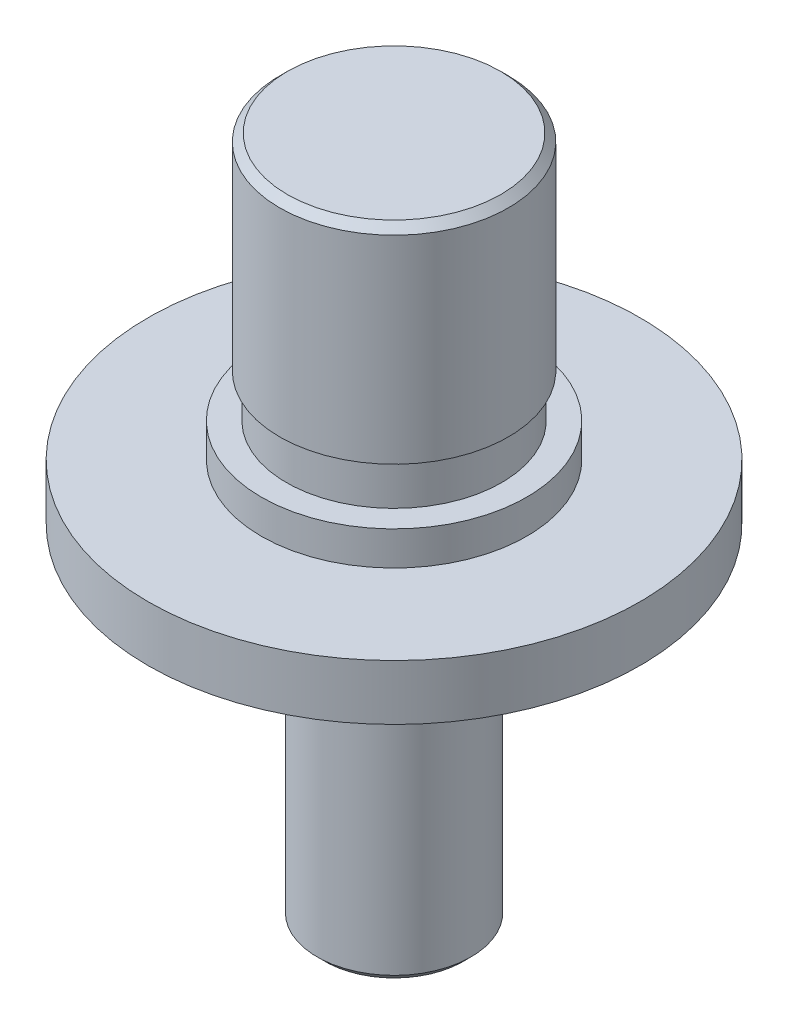
from build123d import *

# Parameters (mm, degrees)
SKETCH16_R         = 52.5
SKETCH16_R_2       = 50.8
CUT_EXTRUDE1_DEPTH = 11.43


with BuildPart() as part:
    # Sketch1 → Bearing Shaft/Flange Support (revolve)
    with BuildSketch(Plane(origin=(0, 0, 0), x_dir=(0, 0, -1), z_dir=(1, 0, 0)), mode=Mode.PRIVATE) as bearing_shaft_flange_support_sk:
        Polygon((0, 0), (-27.254672075, 0), (-25.0825, -12.319), (-25.0825, -17.0815), (-15.875, -17.0815), (-15.875, -69.56298), (-14.2875, -71.15048), (0, -71.15048), align=None)
    revolve(bearing_shaft_flange_support_sk.sketch.rotate(Axis((0, 0, 0), (0, 1, 0)), 180), axis=Axis((0, 0, 0), (0, 1, 0)))

    # Sketch2 → Drive Pin Support (revolve)
    with BuildSketch(Plane(origin=(0, 0, 0), x_dir=(0, 0, -1), z_dir=(1, 0, 0)), mode=Mode.PRIVATE) as drive_pin_support_sk:
        Polygon((0, 0), (-52.5, 0), (-52.5, 11.43), (-27.4096, 11.43), (-27.4096, 18.43), (-22.225, 18.43), (-22.225, 27.305), (-23.61946, 27.305), (-23.61946, 68.2625), (-22.03196, 69.85), (0, 69.85), align=None)
    revolve(drive_pin_support_sk.sketch.rotate(Axis((0, 0, 0), (0, 1, 0)), 180), axis=Axis((0, 0, 0), (0, 1, 0)))

    # Sketch16 → Cut-Extrude1 (cut)
    with BuildSketch(Plane(origin=(0, 11.43, 0), x_dir=(1, 0, 0), z_dir=(0, 1, 0))):
        Circle(SKETCH16_R)
        with Locations(Location((0, 0, 0), (0, 0, 270))):
            Circle(SKETCH16_R_2, mode=Mode.SUBTRACT)
    extrude(amount=-CUT_EXTRUDE1_DEPTH, mode=Mode.SUBTRACT)


solid = part.part
